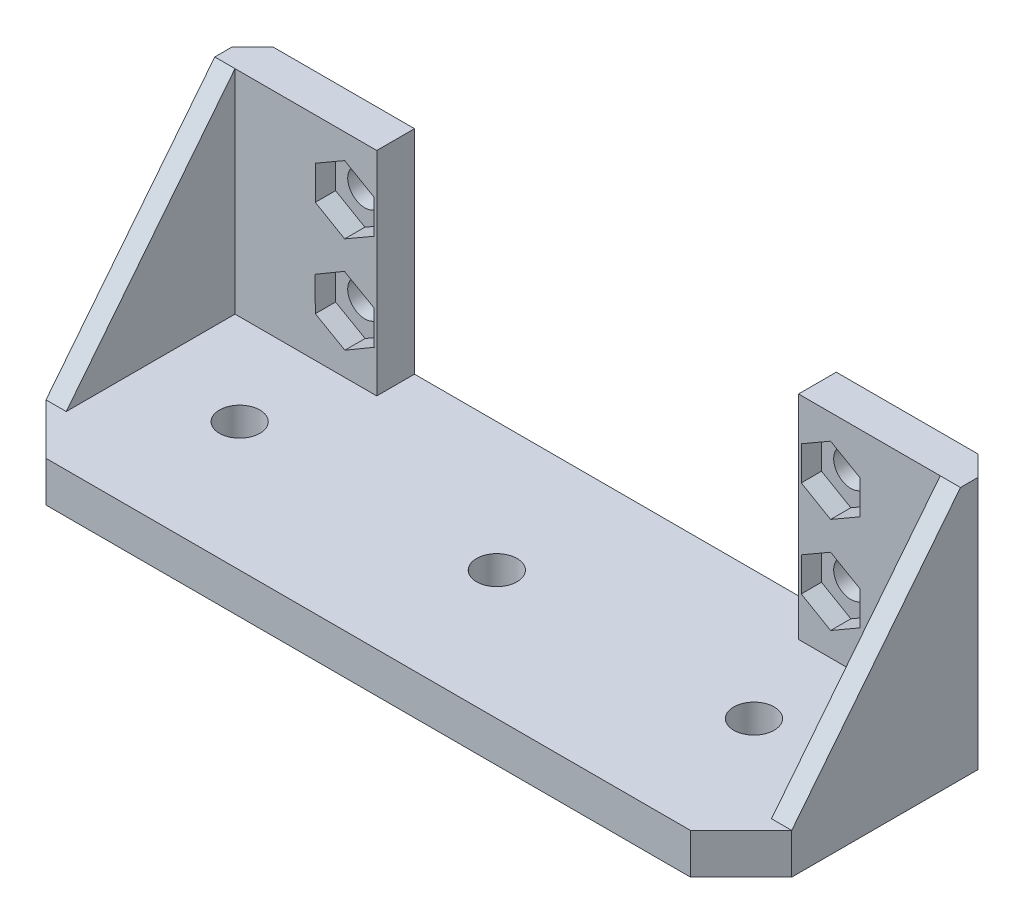
from build123d import *

# Parameters (mm, degrees)
SKETCH1_W           = 73.66
SKETCH1_H           = 25.4
BOSS_EXTRUDE1_DEPTH = 4
CHAMFER1_SIZE       = 5
SKETCH2_R           = 2
SKETCH2_W           = 16
SKETCH2_H           = 3.728527123
BOSS_EXTRUDE2_DEPTH = 21
CUT_EXTRUDE1_START  = -31
SKETCH3_R           = 2
CUT_EXTRUDE1_DEPTH  = 31
BOSS_EXTRUDE3_DEPTH = 2
BOSS_EXTRUDE4_DEPTH = 2
CHAMFER2_SIZE       = 2
SKETCH7_R           = 1.7
CUT_EXTRUDE2_DEPTH  = 12
CUT_EXTRUDE3_DEPTH  = 2


with BuildPart() as part:
    # Sketch1 → Boss-Extrude1 (new body)
    with BuildSketch(Plane(origin=(0, 0, 0), x_dir=(1, 0, 0), z_dir=(0, 1, 0))):
        Rectangle(SKETCH1_W, SKETCH1_H)
    extrude(amount=BOSS_EXTRUDE1_DEPTH)

    # Chamfer1
    chamfer1_edges = [part.edges().sort_by_distance(p)[0] for p in [
        (36.83, 2, 12.7),
        (-36.83, 2, 12.7),
    ]]
    chamfer(chamfer1_edges, length=CHAMFER1_SIZE)

    # Sketch2 → Boss-Extrude2 (add)
    with BuildSketch(Plane(origin=(0, 4, 0), x_dir=(1, 0, 0), z_dir=(0, 1, 0))):
        with Locations(Location((-25.4, 0, 0), (0, 0, 90))):
            Circle(SKETCH2_R)
        with Locations(Location((0, 0, 0), (0, 0, 90))):
            Circle(SKETCH2_R)
        with Locations(Location((25.4, 0, 0), (0, 0, 90))):
            Circle(SKETCH2_R)
        with Locations((-28.83, 10.835736438)):
            Rectangle(SKETCH2_W, SKETCH2_H)
        with Locations((28.83, 10.835736438)):
            Rectangle(SKETCH2_W, SKETCH2_H)
    extrude(amount=BOSS_EXTRUDE2_DEPTH)

    # Sketch3 → Cut-Extrude1 (cut)
    with BuildSketch(Plane(origin=(0, 25, 0), x_dir=(1, 0, 0), z_dir=(0, 1, 0)).offset(CUT_EXTRUDE1_START)):
        with Locations(Location((-25.4, 0, 0), (0, 0, 270))):
            Circle(SKETCH3_R)
        with Locations(Location((0, 0, 0), (0, 0, 270))):
            Circle(SKETCH3_R)
        with Locations(Location((25.4, 0, 0), (0, 0, 270))):
            Circle(SKETCH3_R)
    extrude(amount=CUT_EXTRUDE1_DEPTH, mode=Mode.SUBTRACT)

    # Sketch4 → Boss-Extrude3 (add)
    with BuildSketch(Plane(origin=(36.83, 0, 0), x_dir=(0, 0, -1), z_dir=(1, 0, 0))):
        Polygon((8.971472877, 25), (-7.7, 4), (8.971472877, 4), align=None)
    extrude(amount=-BOSS_EXTRUDE3_DEPTH)

    # Sketch5 → Boss-Extrude4 (add)
    with BuildSketch(Plane.ZY.offset(36.83)):
        Polygon((-8.971472877, 25), (7.7, 4), (-8.971472877, 4), align=None)
    extrude(amount=-BOSS_EXTRUDE4_DEPTH)

    # Chamfer2
    chamfer2_edges = [part.edges().sort_by_distance(p)[0] for p in [
        (-36.83, 12.5, -12.7),
        (36.83, 12.5, -12.7),
    ]]
    chamfer(chamfer2_edges, length=CHAMFER2_SIZE)

    # Sketch7 → Cut-Extrude2 (cut)
    with BuildSketch(Plane.XY.offset(-8.971472877)):
        with Locations((-24, 19.2)):
            Circle(SKETCH7_R)
        with Locations((-24, 9.7)):
            Circle(SKETCH7_R)
        with Locations((24, 19.2)):
            Circle(SKETCH7_R)
        with Locations((24, 9.7)):
            Circle(SKETCH7_R)
    extrude(amount=-CUT_EXTRUDE2_DEPTH, mode=Mode.SUBTRACT)

    # Sketch8 → Cut-Extrude3 (cut)
    with BuildSketch(Plane.XY.offset(-8.971472877)):
        Polygon((-21.1, 17.525684219), (-21.1, 20.874315781), (-24, 22.548631561), (-26.9, 20.874315781), (-26.9, 17.525684219), (-24, 15.851368439), align=None)
        Polygon((-21.1, 11.4), (-24.022243186, 13.061473671), (-26.922243186, 11.361473671), (-26.9, 8), (-23.977756814, 6.338526329), (-21.077756814, 8.038526329), align=None)
        Polygon((21.1, 20.874315781), (21.1, 17.525684219), (24, 15.851368439), (26.9, 17.525684219), (26.9, 20.874315781), (24, 22.548631561), align=None)
        Polygon((21.1, 11.374315781), (21.1, 8.025684219), (24, 6.351368439), (26.9, 8.025684219), (26.9, 11.374315781), (24, 13.048631561), align=None)
    extrude(amount=-CUT_EXTRUDE3_DEPTH, mode=Mode.SUBTRACT)


solid = part.part
